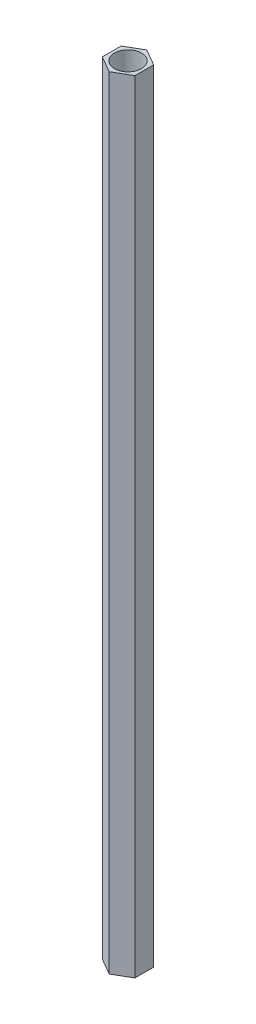
from build123d import *

# Parameters (mm, degrees)
BOSS_EXTRUDE1_DEPTH       = 72
M3X0_5_TAPPED_HOLE1_D     = 2.5
M3X0_5_TAPPED_HOLE1_DEPTH = 10
M3X0_5_TAPPED_HOLE1_TIP   = 0.751075774
M3X0_5_TAPPED_HOLE2_D     = 2.5
M3X0_5_TAPPED_HOLE2_DEPTH = 10
M3X0_5_TAPPED_HOLE2_TIP   = 0.751075774


with BuildPart() as part:
    # Sketch1 → Boss-Extrude1 (new body)
    with BuildSketch(Plane(origin=(0, 0, 0), x_dir=(1, 0, 0), z_dir=(0, 1, 0))):
        Polygon((0, 1.732050808), (-1.5, 0.866025404), (-1.5, -0.866025404), (0, -1.732050808), (1.5, -0.866025404), (1.5, 0.866025404), align=None)
    extrude(amount=BOSS_EXTRUDE1_DEPTH)

    # M3x0.5 Tapped Hole1
    with Locations(Plane(origin=(0, 72, 0), x_dir=(1, 0, 0), z_dir=(0, 1, 0))):
        with Locations((0, 0)):
            Hole(M3X0_5_TAPPED_HOLE1_D / 2, depth=M3X0_5_TAPPED_HOLE1_DEPTH)
            with Locations((0, 0, -(M3X0_5_TAPPED_HOLE1_DEPTH + M3X0_5_TAPPED_HOLE1_TIP / 2))):  # 118° drill point
                Cone(0, M3X0_5_TAPPED_HOLE1_D / 2, M3X0_5_TAPPED_HOLE1_TIP, mode=Mode.SUBTRACT)

    # M3x0.5 Tapped Hole2
    with Locations(Plane(origin=(0, 0, 0), x_dir=(-1, 0, 0), z_dir=(0, -1, 0))):
        with Locations((0, 0)):
            Hole(M3X0_5_TAPPED_HOLE2_D / 2, depth=M3X0_5_TAPPED_HOLE2_DEPTH)
            with Locations((0, 0, -(M3X0_5_TAPPED_HOLE2_DEPTH + M3X0_5_TAPPED_HOLE2_TIP / 2))):  # 118° drill point
                Cone(0, M3X0_5_TAPPED_HOLE2_D / 2, M3X0_5_TAPPED_HOLE2_TIP, mode=Mode.SUBTRACT)


solid = part.part
